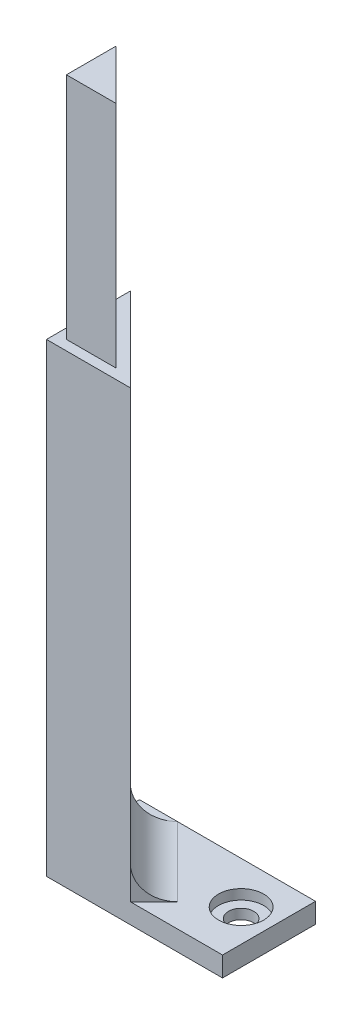
from build123d import *

# Parameters (mm, degrees)
BOSS_EXTRUDE3_DEPTH = 320
SKETCH7_W           = 15
SKETCH7_H           = 111
CUT_EXTRUDE3_DEPTH  = 321.702354216
BOSS_EXTRUDE5_DEPTH = 140
SKETCH4_R           = 3.8
BOSS_EXTRUDE4_DEPTH = 6
BOSS_EXTRUDE6_DEPTH = 10
CUT_EXTRUDE4_DEPTH  = 216.623582748
SKETCH11_R          = 6.8
CUT_EXTRUDE5_DEPTH  = 3


with BuildPart() as part:
    # Sketch1 → Boss-Extrude3 (new body)
    with BuildSketch(Plane(origin=(0, 0, 0), x_dir=(1, 0, 0), z_dir=(0, 1, 0))):
        Polygon((0, 0), (0, 15), (15, 0), align=None)
    extrude(amount=BOSS_EXTRUDE3_DEPTH)

    # Sketch7 → Cut-Extrude3 (cut, through all)
    with BuildSketch(Plane.XY):
        with Locations((7.5, 264.5)):
            Rectangle(SKETCH7_W, SKETCH7_H)
    extrude(amount=-CUT_EXTRUDE3_DEPTH, mode=Mode.SUBTRACT)

    # Sketch8 → Boss-Extrude5 (add)
    with BuildSketch(Plane.XZ):
        Polygon((-3, -22.242640687), (-3, 3), (22.242640687, 3), align=None)
    extrude(amount=-BOSS_EXTRUDE5_DEPTH)

    # Sketch4 → Boss-Extrude4 (add)
    with BuildSketch(Plane.XZ):
        Polygon((22.242640687, 3), (-3, -22.242640687), (-3, -25), (50, -25), (50, 0), (50, 3), align=None)
        with Locations(Location((40.3, -12.3, 0), (0, 0, 270))):
            Circle(SKETCH4_R, mode=Mode.SUBTRACT)
    extrude(amount=-BOSS_EXTRUDE4_DEPTH)

    # Sketch9 → Boss-Extrude6 (add)
    with BuildSketch(Plane(origin=(0, 6, 0), x_dir=(1, 0, 0), z_dir=(0, 1, 0))):
        Polygon((22.242640687, -3), (29.313708499, 4.071067812), (8.384776311, 25), (1.313708499, 17.928932188), align=None)
    extrude(amount=BOSS_EXTRUDE6_DEPTH)

    # Sketch10 → Cut-Extrude4 (cut, through all)
    with BuildSketch(Plane(origin=(12.621320344, 0, 12.621320344), x_dir=(0.7071067811865476, 0, -0.7071067811865476), z_dir=(0.7071067811865476, 0, 0.7071067811865476))):
        with BuildLine():
            Line((13.606601718, 16), (23.606601718, 16))
            Line((23.606601718, 16), (23.606601718, 6))
            ThreePointArc((23.606601718, 6), (16.535533906, 8.928932188), (13.606601718, 16))
        make_face()
    extrude(amount=-CUT_EXTRUDE4_DEPTH, mode=Mode.SUBTRACT)

    # Sketch11 → Cut-Extrude5 (cut)
    with BuildSketch(Plane(origin=(0, 6, 0), x_dir=(1, 0, 0), z_dir=(0, 1, 0))):
        with Locations(Location((40.3, 12.3, 0), (0, 0, 270))):
            Circle(SKETCH11_R)
    extrude(amount=-CUT_EXTRUDE5_DEPTH, mode=Mode.SUBTRACT)


solid = part.part
